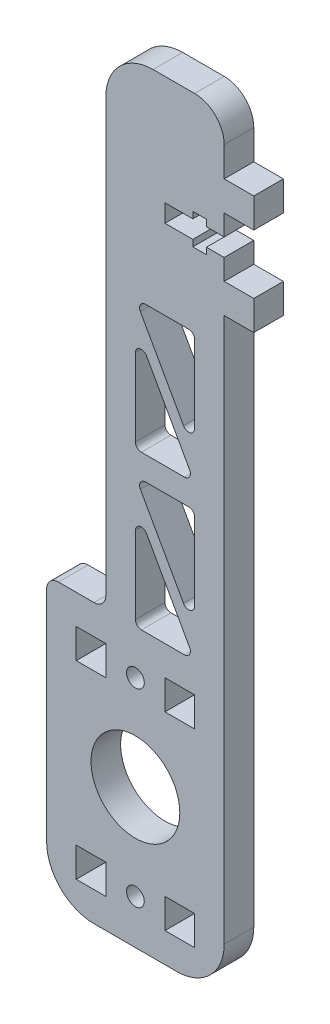
from build123d import *

# Parameters (mm, degrees)
ESQUISSE1_R        = 7.5
ESQUISSE1_R_2      = 1.5
ESQUISSE1_W        = 5
ESQUISSE1_H        = 5
BOSS_EXTRU_1_DEPTH = 5


with BuildPart() as part:
    # Esquisse1 → Boss.-Extru.1 (new body)
    with BuildSketch(Plane.XY):
        with BuildLine():
            Line((0, 0), (0, -92))
            ThreePointArc((0, -92), (-2.343145751, -97.656854249), (-8, -100))
            Line((-8, -100), (-22, -100))
            ThreePointArc((-22, -100), (-27.656854249, -97.656854249), (-30, -92))
            Line((-30, -92), (-30, -55))
            ThreePointArc((-30, -55), (-29.414213562, -53.585786438), (-28, -53))
            Line((-28, -53), (-22, -53))
            ThreePointArc((-22, -53), (-20.585786438, -52.414213562), (-20, -51))
            Line((-20, -51), (-20, 22))
            ThreePointArc((-20, 22), (-17.656854249, 27.656854249), (-12, 30))
            Line((-12, 30), (-5, 30))
            ThreePointArc((-5, 30), (-1.464466094, 28.535533906), (0, 25))
            Line((0, 25), (0, 20))
            Line((0, 20), (5, 20))
            Line((5, 20), (5, 15))
            Line((5, 15), (0, 15))
            Line((0, 15), (0, 11.5))
            Line((0, 11.5), (-3, 11.5))
            Line((-3, 11.5), (-3, 12.6))
            Line((-3, 12.6), (-5.3, 12.6))
            Line((-5.3, 12.6), (-5.3, 11.5))
            Line((-5.3, 11.5), (-10, 11.5))
            Line((-10, 11.5), (-10, 8.5))
            Line((-10, 8.5), (-5.3, 8.5))
            Line((-5.3, 8.5), (-5.3, 7.4))
            Line((-5.3, 7.4), (-3, 7.4))
            Line((-3, 7.4), (-3, 8.5))
            Line((-3, 8.5), (0, 8.5))
            Line((0, 8.5), (0, 5))
            Line((0, 5), (5, 5))
            Line((5, 5), (5, 0))
            Line((5, 0), (0, 0))
        make_face()
        with Locations((-15, -76.5)):
            Circle(ESQUISSE1_R, mode=Mode.SUBTRACT)
        with Locations((-15, -60.5)):
            Circle(ESQUISSE1_R_2, mode=Mode.SUBTRACT)
        with Locations((-15, -92.5)):
            Circle(ESQUISSE1_R_2, mode=Mode.SUBTRACT)
        with Locations((-7.5, -92.5)):
            Rectangle(ESQUISSE1_W, ESQUISSE1_H, mode=Mode.SUBTRACT)
        with Locations((-22.5, -92.5)):
            Rectangle(ESQUISSE1_W, ESQUISSE1_H, mode=Mode.SUBTRACT)
        with Locations((-22.5, -60.5)):
            Rectangle(ESQUISSE1_W, ESQUISSE1_H, mode=Mode.SUBTRACT)
        with Locations((-7.5, -60.5)):
            Rectangle(ESQUISSE1_W, ESQUISSE1_H, mode=Mode.SUBTRACT)
        with BuildLine():
            Line((-6, -5), (-13.295840542, -5))
            ThreePointArc((-13.295840542, -5), (-14.158315423, -5.493900129), (-14.168837394, -6.487725842))
            Line((-14.168837394, -6.487725842), (-6.872996852, -19.546795671))
            ThreePointArc((-6.872996852, -19.546795671), (-5.748004813, -20.026798317), (-5, -19.059069829))
            Line((-5, -19.059069829), (-5, -6))
            ThreePointArc((-5, -6), (-5.292893219, -5.292893219), (-6, -5))
        make_face(mode=Mode.SUBTRACT)
        with BuildLine():
            Line((-13.127003148, -12.453204329), (-5.831162606, -25.512274158))
            ThreePointArc((-5.831162606, -25.512274158), (-5.841684577, -26.506099871), (-6.704159458, -27))
            Line((-6.704159458, -27), (-14, -27))
            ThreePointArc((-14, -27), (-14.707106781, -26.707106781), (-15, -26))
            Line((-15, -26), (-15, -12.940930171))
            ThreePointArc((-15, -12.940930171), (-14.251995187, -11.973201683), (-13.127003148, -12.453204329))
        make_face(mode=Mode.SUBTRACT)
        with BuildLine():
            Line((-6, -31), (-13.295840542, -31))
            ThreePointArc((-13.295840542, -31), (-14.158315423, -31.493900129), (-14.168837394, -32.487725842))
            Line((-14.168837394, -32.487725842), (-6.872996852, -45.546795671))
            ThreePointArc((-6.872996852, -45.546795671), (-5.748004813, -46.026798317), (-5, -45.059069829))
            Line((-5, -45.059069829), (-5, -32))
            ThreePointArc((-5, -32), (-5.292893219, -31.292893219), (-6, -31))
        make_face(mode=Mode.SUBTRACT)
        with BuildLine():
            Line((-13.127003148, -38.453204329), (-5.831162606, -51.512274158))
            ThreePointArc((-5.831162606, -51.512274158), (-5.841684577, -52.506099871), (-6.704159458, -53))
            Line((-6.704159458, -53), (-14, -53))
            ThreePointArc((-14, -53), (-14.707106781, -52.707106781), (-15, -52))
            Line((-15, -52), (-15, -38.940930171))
            ThreePointArc((-15, -38.940930171), (-14.251995187, -37.973201683), (-13.127003148, -38.453204329))
        make_face(mode=Mode.SUBTRACT)
    extrude(amount=BOSS_EXTRU_1_DEPTH)


solid = part.part
